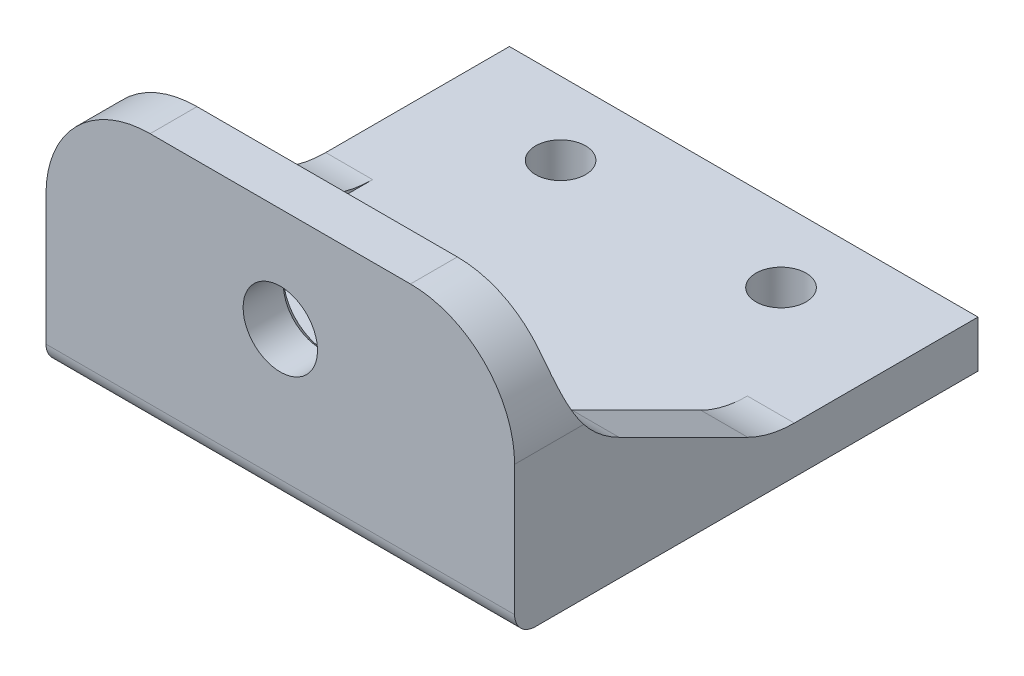
from build123d import *

# Parameters (mm, degrees)
BOSS_EXTRUDE1_DEPTH               = 4.5
M5_CLEARANCE_HOLE1_D              = 5.5
M5_CLEARANCE_HOLE1_CSINK_D        = 5.55
M5_CLEARANCE_HOLE1_CSINK_ANGLE    = 90
SKETCH5_R                         = 12.5
CUT_EXTRUDE1_DEPTH                = 81.825429167
SKETCH12_W                        = 45
SKETCH12_H                        = 24.5
BOSS_EXTRUDE2_DEPTH               = 4.5
F_1_4_CLEARANCE_HOLE1_D           = 7.14248
F_1_4_CLEARANCE_HOLE1_CSINK_D     = 8.41248
F_1_4_CLEARANCE_HOLE1_CSINK_ANGLE = 90
FILLET1_R                         = 10
FILLET2_R                         = 2
SKETCH18_W                        = 106.323058396
SKETCH18_H                        = 71.002809098
CUT_EXTRUDE4_DEPTH                = 60
M4_CLEARANCE_HOLE1_D              = 4.8
BOSS_EXTRUDE3_DEPTH               = 4.5
FILLET3_R                         = 10
FILLET3_OF_MIRROR1_R              = 10


with BuildPart() as part:
    # Sketch1 → Boss-Extrude1 (new body)
    with BuildSketch(Plane(origin=(0, 0, 0), x_dir=(1, 0, 0), z_dir=(0, 1, 0))):
        with BuildLine():
            Line((-22.5, -77.5), (22.5, -77.5))
            Line((22.5, -77.5), (22.5, 3.34e-07))
            ThreePointArc((22.5, 3.34e-07), (0, 22.5), (-22.5, 3.34e-07))
            Line((-22.5, 3.34e-07), (-22.5, -77.5))
        make_face()
    extrude(amount=BOSS_EXTRUDE1_DEPTH)

    # M5 Clearance Hole1 (through all)
    with Locations(Plane(origin=(0, 4.5, 0), x_dir=(1, 0, 0), z_dir=(0, 1, 0))):
        with Locations((-6.696960066, -16.167891819), (6.696960066, -16.167891819), (6.696960066, 16.167891819), (-6.696960066, 16.167891819)):
            CounterSinkHole(M5_CLEARANCE_HOLE1_D / 2, M5_CLEARANCE_HOLE1_CSINK_D / 2, counter_sink_angle=M5_CLEARANCE_HOLE1_CSINK_ANGLE)

    # Sketch5 → Cut-Extrude1 (cut, through all)
    with BuildSketch(Plane(origin=(0, 4.5, 0), x_dir=(1, 0, 0), z_dir=(0, 1, 0))):
        with Locations(Location((0, 0, 0), (0, 0, 270))):
            Circle(SKETCH5_R)
    extrude(amount=-CUT_EXTRUDE1_DEPTH, mode=Mode.SUBTRACT)

    # Sketch12 → Boss-Extrude2 (add)
    with BuildSketch(Plane.XY.offset(77.5)):
        with Locations((0, 12.25)):
            Rectangle(SKETCH12_W, SKETCH12_H)
    extrude(amount=BOSS_EXTRUDE2_DEPTH)

    # 1/4 Clearance Hole1 (through all)
    with Locations(Plane(origin=(0, 0, 77.5), x_dir=(-1, 0, 0), z_dir=(0, 0, -1))):
        with Locations((0, 14.5)):
            CounterSinkHole(F_1_4_CLEARANCE_HOLE1_D / 2, F_1_4_CLEARANCE_HOLE1_CSINK_D / 2, counter_sink_angle=F_1_4_CLEARANCE_HOLE1_CSINK_ANGLE)

    # Fillet1
    fillet1_edges = [part.edges().sort_by_distance(p)[0] for p in [
        (22.5, 24.5, 79.75),
        (-22.5, 24.5, 79.75),
    ]]
    fillet(fillet1_edges, radius=FILLET1_R)

    # Fillet2
    fillet2_edges = [part.edges().sort_by_distance(p)[0] for p in [
        (0, 4.5, 77.5),
        (0, 0, 82),
    ]]
    fillet(fillet2_edges, radius=FILLET2_R)

    # Sketch18 → Cut-Extrude4 (cut)
    with BuildSketch(Plane.XY.offset(-22.5)):
        with Locations((20.664180994, 31.016391908)):
            Rectangle(SKETCH18_W, SKETCH18_H)
    extrude(amount=CUT_EXTRUDE4_DEPTH, mode=Mode.SUBTRACT)

    # M4 Clearance Hole1 (through all)
    with Locations(Plane(origin=(0, 0, 0), x_dir=(-1, 0, 0), z_dir=(0, -1, 0))):
        with Locations((10.58478565, -44.5), (-10.58478565, -44.5)):
            Hole(M4_CLEARANCE_HOLE1_D / 2)

    # Sketch23 → Boss-Extrude3 (add)
    with BuildSketch(Plane.ZY.offset(22.5)):
        Polygon((77.5, 14.5), (57.5, 4.5), (77.5, 4.5), align=None)
    boss_extrude3 = extrude(amount=-BOSS_EXTRUDE3_DEPTH)

    # Fillet3
    fillet3_edges = [part.edges().sort_by_distance(p)[0] for p in [
        (-20.25, 14.5, 77.5),
        (-20.25, 4.5, 57.5),
    ]]
    fillet(fillet3_edges, radius=FILLET3_R)

    # Mirror1: Boss-Extrude3 across plane
    add(boss_extrude3.mirror(Plane(origin=(0, 0, 0), x_dir=(0, 0, 1), z_dir=(1, 0, 0))))

    # Fillet3 of Mirror1
    fillet3_of_mirror1_edges = [part.edges().sort_by_distance(p)[0] for p in [
        (20.25, 14.5, 77.5),
        (20.25, 4.5, 57.5),
    ]]
    fillet(fillet3_of_mirror1_edges, radius=FILLET3_OF_MIRROR1_R)


solid = part.part
